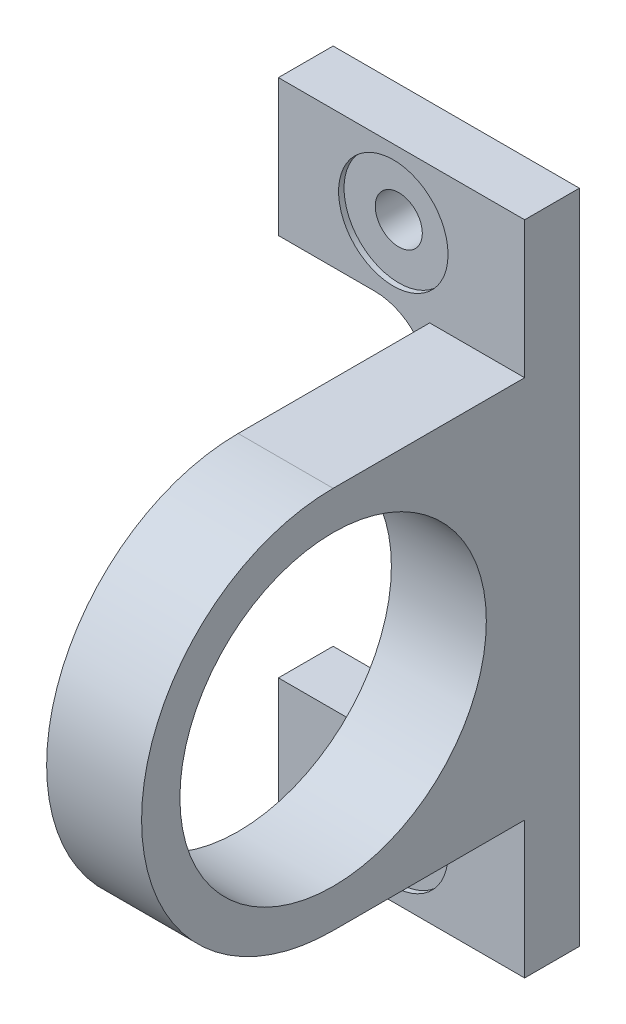
from build123d import *

# Parameters (mm, degrees)
EXTRUDE_2_DEPTH                = 5
SKETCH_4_W                     = 8.676470589
SKETCH_4_H                     = 35
SKETCH_4_W_2                   = 8.676470588
EXTRUDE_15_DEPTH               = 35
CUT_EXTRUDE_1_DEPTH            = 45
SKETCH_6_R                     = 14
CUT_EXTRUDE_2_DEPTH            = 45
FILLET_1_R                     = 5
SKETCH_7_R                     = 15
SKETCH_7_R_2                   = 13
EXTRUDE_16_DEPTH               = 1
SPLIT_BODIES_1_SURFACE_1_BACK  = 86
SPLIT_BODIES_1_SURFACE_1_DEPTH = 172
SPLIT_BODIES_1_SURFACE_2_BACK  = 86
SPLIT_BODIES_1_SURFACE_2_DEPTH = 172
HOLE_WIZARD_1_D                = 4.3
HOLE_WIZARD_1_DEPTH            = 5
HOLE_WIZARD_1_CBORE_D          = 10
HOLE_WIZARD_1_CBORE_DEPTH      = 0.5
HOLE_WIZARD_1_TIP              = 1.291850331


with BuildPart() as part:
    # 草图2 → 凸台-拉伸2 (new body)
    with BuildSketch(Plane.XY):
        Polygon((7.726423565, 24.338235294), (-14.773576435, 24.338235294), (-14.773576435, -35.661764706), (7.726423565, -35.661764706), (7.726423565, -23.161764706), (-6.097105846, -23.161764706), (-6.097105846, 11.838235294), (7.726423565, 11.838235294), align=None)
        Polygon((30.226423565, 24.338235294), (7.726423565, 24.338235294), (7.726423565, 11.838235294), (21.549952977, 11.838235294), (21.549952977, -23.161764706), (7.726423565, -23.161764706), (7.726423565, -35.661764706), (30.226423565, -35.661764706), align=None)
    extrude(amount=EXTRUDE_2_DEPTH)

    # 草图4 → 凸台-拉伸15 (add)
    with BuildSketch(Plane.XY.offset(5)):
        with Locations((-10.435341141, -5.661764706)):
            Rectangle(SKETCH_4_W, SKETCH_4_H)
        with Locations((25.888188271, -5.661764706)):
            Rectangle(SKETCH_4_W_2, SKETCH_4_H)
    extrude(amount=EXTRUDE_15_DEPTH)

    # 草图5 → 切除-拉伸1 (cut)
    with BuildSketch(Plane.ZY.offset(14.773576435)):
        with BuildLine():
            Line((40, -23.161764706), (40, -5.661764706))
            ThreePointArc((40, -5.661764706), (34.874368671, -18.036133377), (22.5, -23.161764706))
            Line((22.5, -23.161764706), (40, -23.161764706))
        make_face()
        with BuildLine():
            ThreePointArc((22.5, 11.838235294), (34.874368671, 6.712603965), (40, -5.661764706))
            Line((40, -5.661764706), (40, 11.838235294))
            Line((40, 11.838235294), (22.5, 11.838235294))
        make_face()
    extrude(amount=-CUT_EXTRUDE_1_DEPTH, mode=Mode.SUBTRACT)

    # 草图6 → 切除-拉伸2 (cut)
    with BuildSketch(Plane.ZY.offset(14.773576435)):
        with Locations((22.5, -5.661764706)):
            Circle(SKETCH_6_R)
    extrude(amount=-CUT_EXTRUDE_2_DEPTH, mode=Mode.SUBTRACT)

    # 圆角1
    fillet_1_edges = [part.edges().sort_by_distance(p)[0] for p in [
        (-6.097105846, 11.838235294, 2.5),
        (-6.097105846, -23.161764706, 2.5),
        (21.549952977, -23.161764706, 2.5),
        (21.549952977, 11.838235294, 2.5),
    ]]
    fillet(fillet_1_edges, radius=FILLET_1_R)

    # 草图7 → 凸台-拉伸16 (add)
    with BuildSketch(Plane(origin=(-6.097105846, 0, 0), x_dir=(0, 0, -1), z_dir=(1, 0, 0))):
        with Locations((-22.5, -5.661764706)):
            Circle(SKETCH_7_R)
        with Locations((-22.5, -5.661764706)):
            Circle(SKETCH_7_R_2, mode=Mode.SUBTRACT)
    extrude(amount=-EXTRUDE_16_DEPTH)


with BuildPart() as body_2:
    # Split Bodies 1: the piece behind the surface
    add(part.part)
    # Split Bodies 1 surface: a surface, the sketch's curves swept straight by 172 mm
    with BuildLine(Plane.XY.offset(5).offset(-SPLIT_BODIES_1_SURFACE_1_BACK), mode=Mode.PRIVATE) as split_bodies_1_surface_1_path:
        Line((7.726423565, 24.338235294), (7.726423565, -35.661764706))
    split_bodies_1_surface_1 = Shell.extrude(split_bodies_1_surface_1_path.wire(), (0 * SPLIT_BODIES_1_SURFACE_1_DEPTH, 0 * SPLIT_BODIES_1_SURFACE_1_DEPTH, 1 * SPLIT_BODIES_1_SURFACE_1_DEPTH))
    split(bisect_by=split_bodies_1_surface_1, keep=Keep.BOTTOM)


with BuildPart() as part_1:
    add(part.part)

    # Split Bodies 1: split by a surface, the side it looks to stays
    # Split Bodies 1 surface: a surface, the sketch's curves swept straight by 172 mm
    with BuildLine(Plane.XY.offset(5).offset(-SPLIT_BODIES_1_SURFACE_2_BACK), mode=Mode.PRIVATE) as split_bodies_1_surface_2_path:
        Line((7.726423565, 24.338235294), (7.726423565, -35.661764706))
    split_bodies_1_surface_2 = Shell.extrude(split_bodies_1_surface_2_path.wire(), (0 * SPLIT_BODIES_1_SURFACE_2_DEPTH, 0 * SPLIT_BODIES_1_SURFACE_2_DEPTH, 1 * SPLIT_BODIES_1_SURFACE_2_DEPTH))
    split(bisect_by=split_bodies_1_surface_2, keep=Keep.TOP)

    # 打孔尺寸(%根据六角头螺)栓 全螺纹的类型1
    with Locations(Plane(origin=(18.226423565, 18.088235294, 5), x_dir=(1, 0, 0), z_dir=(0, 0, 1))):
        with Locations((0, 0), (0, -47.5)):
            CounterBoreHole(HOLE_WIZARD_1_D / 2, HOLE_WIZARD_1_CBORE_D / 2, HOLE_WIZARD_1_CBORE_DEPTH, depth=HOLE_WIZARD_1_DEPTH)
            with Locations((0, 0, -(HOLE_WIZARD_1_DEPTH + HOLE_WIZARD_1_TIP / 2))):  # 118° drill point
                Cone(0, HOLE_WIZARD_1_D / 2, HOLE_WIZARD_1_TIP, mode=Mode.SUBTRACT)


solid = part_1.part
